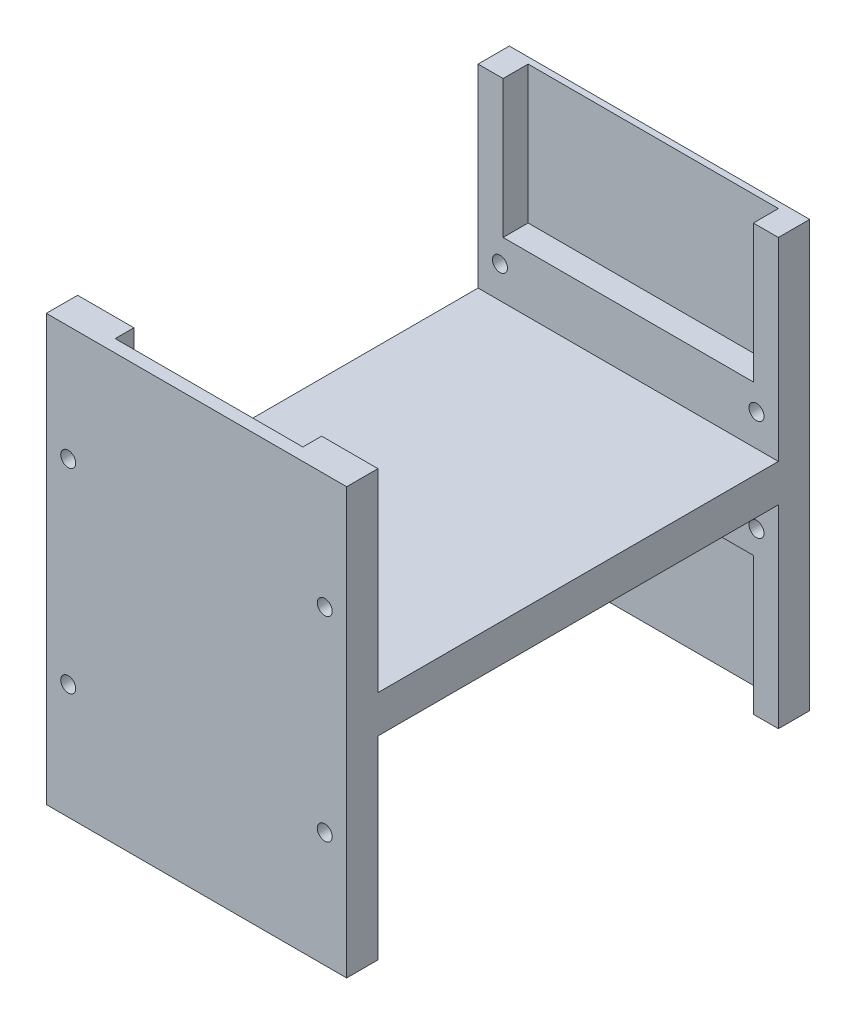
from build123d import *

# Parameters (mm, degrees)
SKETCH_1_W          = 24
SKETCH_1_H          = 17
EXTRUDE_1_DEPTH     = 37
CUT_EXTRUDE_1_DEPTH = 15.5
CUT_EXTRUDE_2_REACH = 49.265
SKETCH_3_R          = 0.6
CUT_EXTRUDE_3_REACH = 49.265
SKETCH_4_R          = 0.6
SKETCH_5_W          = 20
SKETCH_5_H          = 2
CUT_EXTRUDE_4_DEPTH = 11
SKETCH_6_W          = 15
SKETCH_6_H          = 1.5
CUT_EXTRUDE_5_DEPTH = 15


with BuildPart() as part:
    # 草图1 → 凸台-拉伸1 (new body)
    with BuildSketch(Plane.XY):
        with Locations((12, 8.5)):
            Rectangle(SKETCH_1_W, SKETCH_1_H)
    extrude(amount=EXTRUDE_1_DEPTH)

    # 草图2 → 切除-拉伸1 (cut)
    with BuildSketch(Plane.XZ):
        Polygon((24, 34.5), (0, 34.5), (0, 18.5), (0, 2.5), (24, 2.5), align=None)
    extrude(amount=-CUT_EXTRUDE_1_DEPTH, mode=Mode.SUBTRACT)

    # 草图3 → 切除-拉伸2 (cut, up to next)
    with BuildSketch(Plane.XY.offset(37), mode=Mode.PRIVATE) as cut_extrude_2_sk1:
        with Locations((1.75, 9.2)):
            Circle(SKETCH_3_R)
    cut_extrude_2_tool1 = extrude(cut_extrude_2_sk1.sketch, amount=-CUT_EXTRUDE_2_REACH, mode=Mode.PRIVATE) & part.part
    # 草图3 → 切除-拉伸2 (cut, up to next)
    with BuildSketch(Plane.XY.offset(37), mode=Mode.PRIVATE) as cut_extrude_2_sk2:
        with Locations((22.25, 9.2)):
            Circle(SKETCH_3_R)
    cut_extrude_2_tool2 = extrude(cut_extrude_2_sk2.sketch, amount=-CUT_EXTRUDE_2_REACH, mode=Mode.PRIVATE) & part.part
    add(cut_extrude_2_tool1.solids().sort_by_distance((1.75, 9.2, 37))[0], mode=Mode.SUBTRACT)
    add(cut_extrude_2_tool2.solids().sort_by_distance((22.25, 9.2, 37))[0], mode=Mode.SUBTRACT)

    # 草图4 → 切除-拉伸3 (cut, up to next)
    with BuildSketch(Plane(origin=(0, 0, 0), x_dir=(-1, 0, 0), z_dir=(0, 0, -1)), mode=Mode.PRIVATE) as cut_extrude_3_sk1:
        with Locations((-22.25, 12.95)):
            Circle(SKETCH_4_R)
    cut_extrude_3_tool1 = extrude(cut_extrude_3_sk1.sketch, amount=-CUT_EXTRUDE_3_REACH, mode=Mode.PRIVATE) & part.part
    # 草图4 → 切除-拉伸3 (cut, up to next)
    with BuildSketch(Plane(origin=(0, 0, 0), x_dir=(-1, 0, 0), z_dir=(0, 0, -1)), mode=Mode.PRIVATE) as cut_extrude_3_sk2:
        with Locations((-1.75, 12.95)):
            Circle(SKETCH_4_R)
    cut_extrude_3_tool2 = extrude(cut_extrude_3_sk2.sketch, amount=-CUT_EXTRUDE_3_REACH, mode=Mode.PRIVATE) & part.part
    add(cut_extrude_3_tool1.solids().sort_by_distance((22.25, 12.95, 0))[0], mode=Mode.SUBTRACT)
    add(cut_extrude_3_tool2.solids().sort_by_distance((1.75, 12.95, 0))[0], mode=Mode.SUBTRACT)

    # 草图5 → 切除-拉伸4 (cut)
    with BuildSketch(Plane.XZ):
        with Locations((12, 1.5)):
            Rectangle(SKETCH_5_W, SKETCH_5_H)
    extrude(amount=-CUT_EXTRUDE_4_DEPTH, mode=Mode.SUBTRACT)

    # 草图6 → 切除-拉伸5 (cut)
    with BuildSketch(Plane.XZ):
        with Locations((12, 35.25)):
            Rectangle(SKETCH_6_W, SKETCH_6_H)
    extrude(amount=-CUT_EXTRUDE_5_DEPTH, mode=Mode.SUBTRACT)

    # 镜向1: part across plane


with BuildPart() as part_1:
    add(part.part)
    add(part.part.mirror(Plane.ZX.offset(17)))


solid = part_1.part
